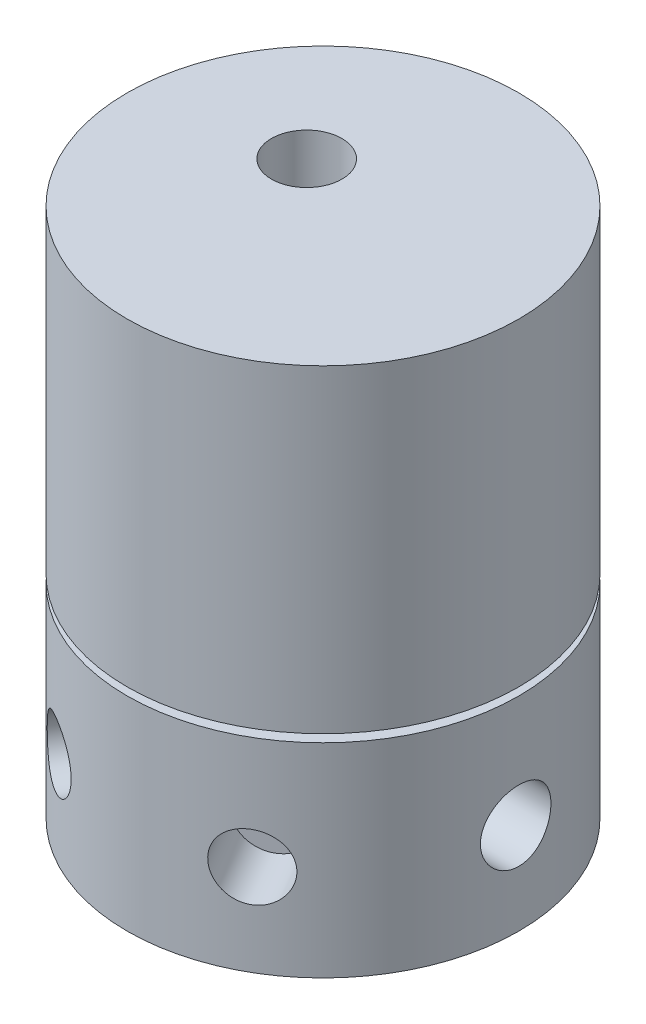
from build123d import *

# Parameters (mm, degrees)
SKETCH1_R           = 38.1
BOSS_EXTRUDE1_DEPTH = 39.624
SKETCH2_R           = 22.606
BOSS_EXTRUDE2_DEPTH = 12.7
SKETCH3_R           = 38.1
BOSS_EXTRUDE3_DEPTH = 61.976
CUT_EXTRUDE1_START  = 25.4
SKETCH4_R           = 6.858
CUT_EXTRUDE1_DEPTH  = 12.7
CUT_EXTRUDE2_START  = -25.4
SKETCH5_R           = 9.525
CUT_EXTRUDE2_DEPTH  = 12.7
SKETCH7_R           = 6.35
CUT_EXTRUDE3_DEPTH  = 12.7
SKETCH8_R           = 6.35
CUT_EXTRUDE5_DEPTH  = 12.7
SKETCH9_R           = 6.858
CUT_EXTRUDE6_DEPTH  = 12.7


with BuildPart() as part:
    # Sketch1 → Boss-Extrude1 (new body)
    with BuildSketch(Plane(origin=(0, 0, 0), x_dir=(1, 0, 0), z_dir=(0, 1, 0))):
        with Locations(Location((0, 0, 0), (0, 0, 270))):
            Circle(SKETCH1_R)
    extrude(amount=BOSS_EXTRUDE1_DEPTH)

    # Sketch2 → Boss-Extrude2 (add)
    with BuildSketch(Plane(origin=(0, 39.624, 0), x_dir=(1, 0, 0), z_dir=(0, 1, 0))):
        with Locations(Location((0, 0, 0), (0, 0, 270))):
            Circle(SKETCH2_R)
    extrude(amount=BOSS_EXTRUDE2_DEPTH)

    # Sketch3 → Boss-Extrude3 (add)
    with BuildSketch(Plane(origin=(0, 41.148, 0), x_dir=(1, 0, 0), z_dir=(0, 1, 0))):
        with Locations(Location((0, 0, 0), (0, 0, 270))):
            Circle(SKETCH3_R)
    extrude(amount=BOSS_EXTRUDE3_DEPTH)

    # Sketch4 → Cut-Extrude1 (cut)
    with BuildSketch(Plane(origin=(0, 0, 0), x_dir=(0, 0, -1), z_dir=(1, 0, 0)).offset(CUT_EXTRUDE1_START)):
        with Locations(Location((0, 17.78, 0), (0, 0, 270))):
            Circle(SKETCH4_R)
    extrude(amount=CUT_EXTRUDE1_DEPTH, mode=Mode.SUBTRACT)

    # Sketch5 → Cut-Extrude2 (cut)
    with BuildSketch(Plane(origin=(0, 0, 0), x_dir=(0, 0, -1), z_dir=(1, 0, 0)).offset(CUT_EXTRUDE2_START)):
        with Locations((0, 17.78)):
            Circle(SKETCH5_R)
    extrude(amount=-CUT_EXTRUDE2_DEPTH, mode=Mode.SUBTRACT)

    # Sketch7 → Cut-Extrude3 (cut)
    with BuildSketch(Plane(origin=(-19.05, 0, 32.995567884), x_dir=(0.8660254037844415, 0, 0.49999999999999517), z_dir=(-0.4999999999999951, 0, 0.8660254037844414))):
        with Locations((0, 17.78)):
            Circle(SKETCH7_R)
    extrude(amount=-CUT_EXTRUDE3_DEPTH, mode=Mode.SUBTRACT)

    # Sketch8 → Cut-Extrude5 (cut)
    with BuildSketch(Plane(origin=(19.05, 0, 32.995567884), x_dir=(0.8660254037844417, 0, -0.49999999999999467), z_dir=(0.49999999999999467, 0, 0.8660254037844417))):
        with Locations((0, 17.78)):
            Circle(SKETCH8_R)
    extrude(amount=-CUT_EXTRUDE5_DEPTH, mode=Mode.SUBTRACT)

    # Sketch9 → Cut-Extrude6 (cut)
    with BuildSketch(Plane(origin=(0, 103.124, 0), x_dir=(1, 0, 0), z_dir=(0, 1, 0))):
        with Locations(Location((-9.525, 6.35, 0), (0, 0, 270))):
            Circle(SKETCH9_R)
    extrude(amount=-CUT_EXTRUDE6_DEPTH, mode=Mode.SUBTRACT)


solid = part.part
